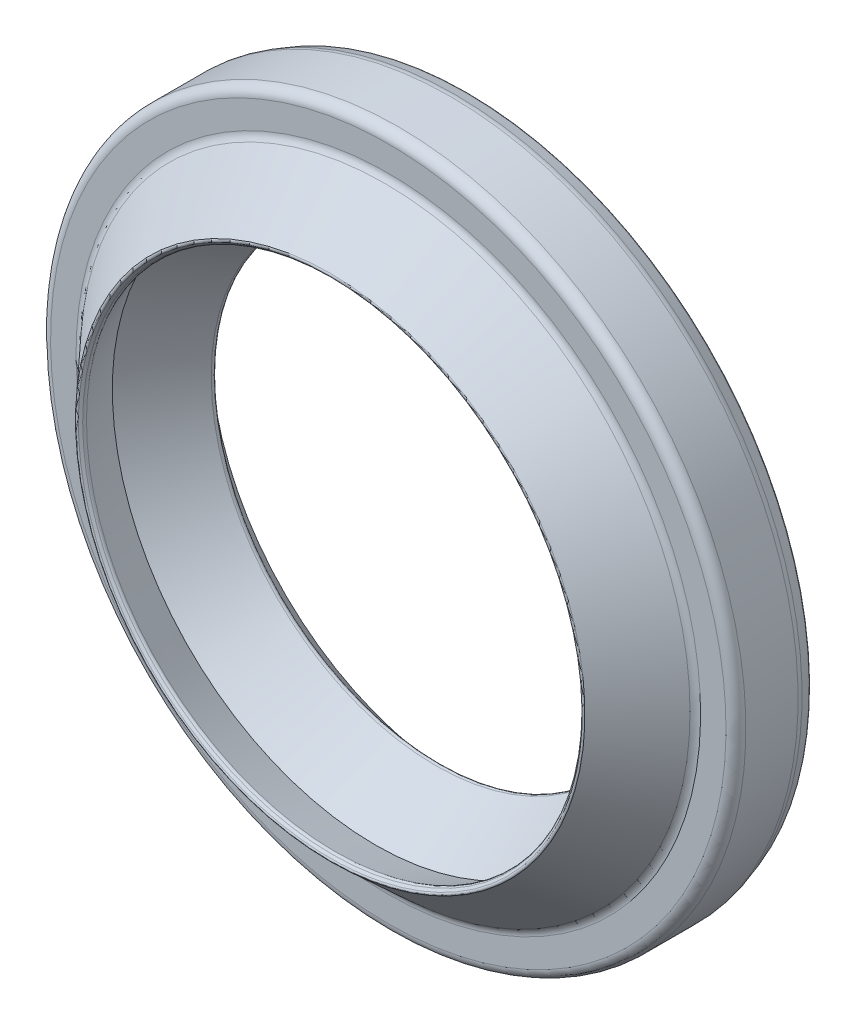
from build123d import *

# Parameters (mm, degrees)
FILLET_1_R = 1
FILLET_2_R = 0.2
FILLET_3_R = 1
FILLET_4_R = 0.3
FILLET_5_R = 1.5
FILLET_6_R = 0.3
FILLET_7_R = 0.5
FILLET_8_R = 0.3
SKETCH_5_R = 0.75


with BuildPart() as part:
    # Эскиз1 → Повернуть1 (revolve)
    with BuildSketch(Plane(origin=(0, 0, 0), x_dir=(0, 0, -1), z_dir=(1, 0, 0))):
        with BuildLine():
            Line((-13.634063952, 25.134063952), (-14, 25.5))
            Line((-14, 25.5), (-8, 31))
            Line((-8, 31), (-8, 35))
            Line((-8, 35), (-1.5, 35))
            Line((-1.5, 35), (0, 34.5))
            Line((0, 34.5), (0, 31.5))
            Line((0, 31.5), (-7, 31.5))
            Line((-7, 31.5), (-7, 27.5))
            Line((-7, 27.5), (-1.75, 27.5))
            ThreePointArc((-1.75, 27.5), (-1, 26.75), (-0.25, 27.5))
            Line((-0.25, 27.5), (-0.25, 25.703470277))
            Line((-0.25, 25.703470277), (-2.809513055, 22.683098187))
            ThreePointArc((-2.809513055, 22.683098187), (-2.993467268, 22.580431153), (-3.199571431, 22.624028701))
            Line((-3.199571431, 22.624028701), (-9.283884091, 26.5))
            Line((-9.283884091, 26.5), (-13.321373279, 25.063551403))
            ThreePointArc((-13.321373279, 25.063551403), (-13.487925558, 25.05354459), (-13.634063952, 25.134063952))
        make_face()
    revolve(axis=Axis((0, 0, 0), (0, 0, 1)))

    # Скругление1
    fillet_1_edges = [part.edges().sort_by_distance(p)[0] for p in [
        (0, -31, 8),
    ]]
    fillet(fillet_1_edges, radius=FILLET_1_R)

    # Скругление2
    fillet_2_edges = [part.edges().sort_by_distance(p)[0] for p in [
        (0, -25.5, 14),
    ]]
    fillet(fillet_2_edges, radius=FILLET_2_R)

    # Скругление3
    fillet_3_edges = [part.edges().sort_by_distance(p)[0] for p in [
        (0, -35, 8),
    ]]
    fillet(fillet_3_edges, radius=FILLET_3_R)

    # Скругление4
    fillet_4_edges = [part.edges().sort_by_distance(p)[0] for p in [
        (0, -34.5, 0),
    ]]
    fillet(fillet_4_edges, radius=FILLET_4_R)

    # Скругление5
    fillet_5_edges = [part.edges().sort_by_distance(p)[0] for p in [
        (0, -35, 1.5),
    ]]
    fillet(fillet_5_edges, radius=FILLET_5_R)

    # Скругление6
    fillet_6_edges = [part.edges().sort_by_distance(p)[0] for p in [
        (0, -31.5, 0),
    ]]
    fillet(fillet_6_edges, radius=FILLET_6_R)

    # Скругление7
    fillet_7_edges = [part.edges().sort_by_distance(p)[0] for p in [
        (0, -31.5, 7),
    ]]
    fillet(fillet_7_edges, radius=FILLET_7_R)

    # Скругление8
    fillet_8_edges = [part.edges().sort_by_distance(p)[0] for p in [
        (0, -27.5, 7),
    ]]
    fillet(fillet_8_edges, radius=FILLET_8_R)


with BuildPart() as body_2:
    # Эскиз5 → Повернуть2 (revolve)
    with BuildSketch(Plane(origin=(0, 0, 0), x_dir=(0, 0, -1), z_dir=(1, 0, 0)), mode=Mode.PRIVATE) as revolve_2_sk:
        with Locations((-1, 27.5)):
            Circle(SKETCH_5_R)
    revolve(revolve_2_sk.sketch.rotate(Axis((0, 0, 0), (0, 0, -1)), 180), axis=Axis((0, 0, 0), (0, 0, -1)))


solid = Compound([part.part, body_2.part])
